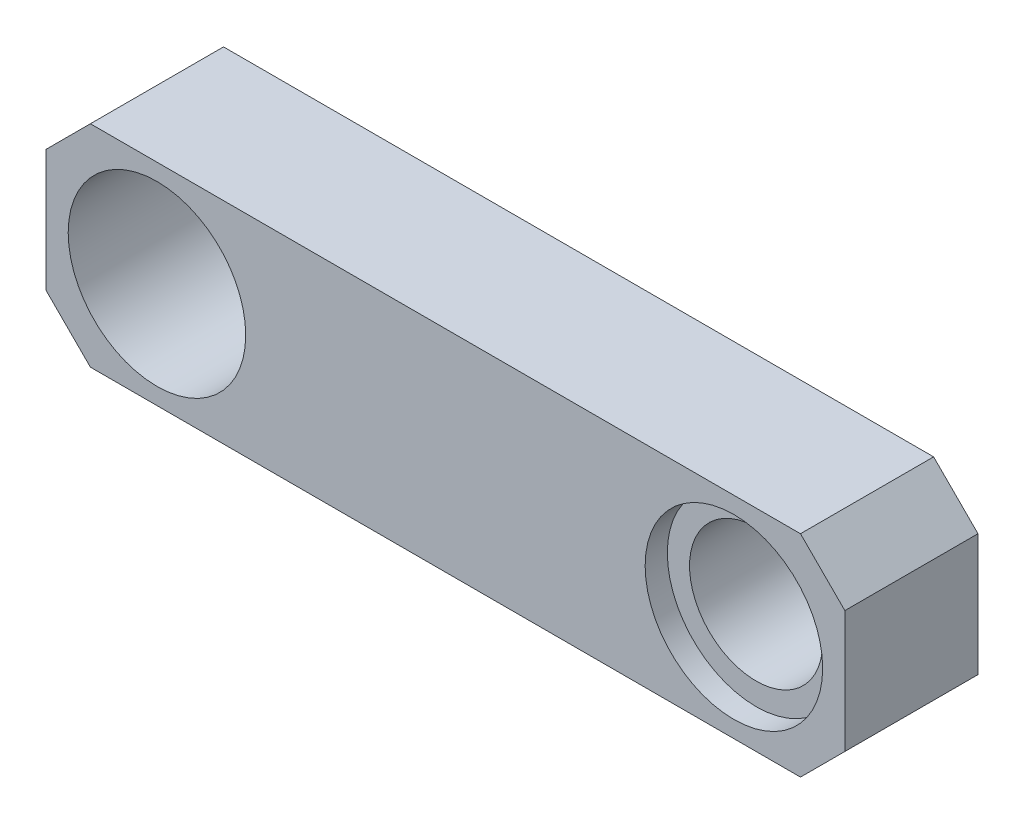
from build123d import *

# Parameters (mm, degrees)
SKETCH_1_W               = 36
SKETCH_1_H               = 9.5
EXTRUDE_1_DEPTH          = 3
CUT_EXTRUDE_1_DEPTH      = 20.559204994
CUT_EXTRUDE_1_DEPTH_BACK = 20.559204994
SKETCH_2_R               = 4
CUT_EXTRUDE_2_DEPTH      = 20.559204994
CUT_EXTRUDE_2_DEPTH_BACK = 1
SKETCH_3_R               = 4
SKETCH_4_R               = 3
CUT_EXTRUDE_3_DEPTH      = 20.275956526
CHAMFER_1_SIZE           = 2


with BuildPart() as part:
    # 草图1 → 凸台-拉伸1 (new, symmetric)
    with BuildSketch(Plane.XY):
        Rectangle(SKETCH_1_W, SKETCH_1_H)
    extrude(amount=EXTRUDE_1_DEPTH, both=True)

    # 草图2 → 切除-拉伸1 (cut, two sides: drawn at the far end of the back side and taken through both)
    with BuildSketch(Plane.XY.offset(3).offset(-CUT_EXTRUDE_1_DEPTH_BACK)):
        with Locations((-13, 0)):
            Circle(SKETCH_2_R)
    extrude(amount=CUT_EXTRUDE_1_DEPTH + CUT_EXTRUDE_1_DEPTH_BACK, mode=Mode.SUBTRACT)

    # 草图3 → 切除-拉伸2 (cut, two sides: drawn at the far end of the back side and taken through both)
    with BuildSketch(Plane.XY.offset(3).offset(-CUT_EXTRUDE_2_DEPTH_BACK)):
        with Locations(Location((13, 0, 0), (0, 0, 180))):
            Circle(SKETCH_3_R)
    extrude(amount=CUT_EXTRUDE_2_DEPTH + CUT_EXTRUDE_2_DEPTH_BACK, mode=Mode.SUBTRACT)

    # 草图4 → 切除-拉伸3 (cut, through all)
    with BuildSketch(Plane.XY.offset(2)):
        with Locations((13, 0)):
            Circle(SKETCH_4_R)
    extrude(amount=-CUT_EXTRUDE_3_DEPTH, mode=Mode.SUBTRACT)

    # 倒角1
    chamfer_1_edges = [part.edges().sort_by_distance(p)[0] for p in [
        (18, -4.75, 0),
        (-18, -4.75, 0),
        (-18, 4.75, 0),
        (18, 4.75, 0),
    ]]
    chamfer(chamfer_1_edges, length=CHAMFER_1_SIZE)


solid = part.part
